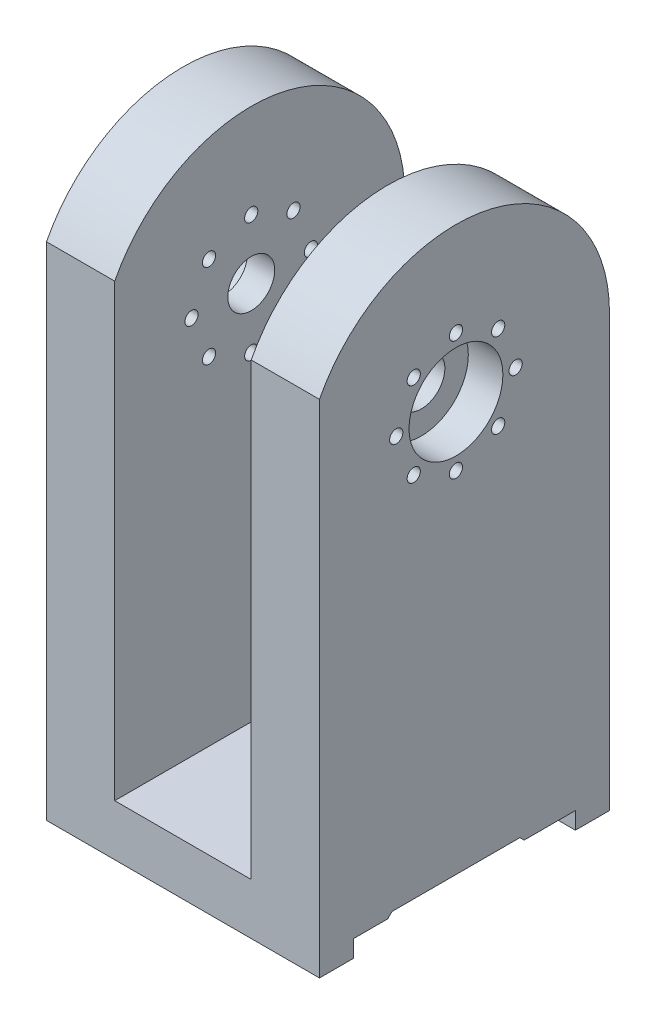
from build123d import *

# Parameters (mm, degrees)
BOSS_EXTRUDE1_DEPTH          = 101.6
CUT_EXTRUDE1_DEPTH           = 264.20443605
CUT_EXTRUDE1_DEPTH_BACK      = 264.20443605
SKETCH5_R                    = 17.4625
CUT_EXTRUDE4_DEPTH           = 15.24
CUT_EXTRUDE5_DEPTH           = 264.20443605
CUT_EXTRUDE5_DEPTH_BACK      = 264.20443605
SKETCH6_R                    = 8.73125
CUT_EXTRUDE6_START           = -12.85875
SKETCH7_R                    = 17.4625
CUT_EXTRUDE6_DEPTH           = 12.85875
F_1_4_20_TAPPED_HOLE1_D      = 5.1054
F_1_4_20_TAPPED_HOLE1_DEPTH  = 16.51
F_1_4_20_TAPPED_HOLE1_TIP    = 1.533816902
F_10_24_TAPPED_HOLE1_D       = 3.7973
F_10_24_TAPPED_HOLE1_DEPTH   = 14.9479
F_10_24_TAPPED_HOLE1_TIP     = 1.140824014
F_1_4_0_25_DIAMETER_HOLE1_D  = 6.35
F_10_0_1935_DIAMETER_HOLE1_D = 4.9149
CUT_EXTRUDE7_REACH           = 256.481
F_1_4_20_TAPPED_HOLE2_D      = 5.1054
F_1_4_20_TAPPED_HOLE2_DEPTH  = 16.51
F_1_4_20_TAPPED_HOLE2_TIP    = 1.533816902


with BuildPart() as part:
    # Sketch1 → Boss-Extrude1 (new body)
    with BuildSketch(Plane(origin=(0, 0, 0), x_dir=(0, 0, -1), z_dir=(1, 0, 0))):
        with BuildLine():
            Line((107.95, 160.3375), (107.95, 0))
            Line((107.95, 0), (95.25, 0))
            Line((95.25, 0), (95.25, 6.35))
            Line((95.25, 6.35), (76.2, 6.35))
            Line((76.2, 6.35), (74.6125, 7.9375))
            Line((74.6125, 7.9375), (26.9875, 7.9375))
            Line((26.9875, 7.9375), (25.4, 6.35))
            Line((25.4, 6.35), (12.7, 6.35))
            Line((12.7, 6.35), (12.7, 0))
            Line((12.7, 0), (0, 0))
            Line((0, 0), (0, 186.519220723))
            ThreePointArc((0, 186.519220723), (64.270384182, 215.877316798), (107.95, 160.3375))
        make_face()
    extrude(amount=BOSS_EXTRUDE1_DEPTH)

    # Sketch2 → Cut-Extrude1 (cut, two sides: drawn at the far end of the back side and taken through both)
    with BuildSketch(Plane(origin=(0, 0, -107.95), x_dir=(-1, 0, 0), z_dir=(0, 0, -1)).offset(-CUT_EXTRUDE1_DEPTH_BACK)):
        Polygon((-76.2, 98.425), (-76.2, 19.05), (-25.4, 19.05), (-25.4, 264.580157132), (-76.2, 264.580157132), align=None)
    extrude(amount=CUT_EXTRUDE1_DEPTH + CUT_EXTRUDE1_DEPTH_BACK, mode=Mode.SUBTRACT)

    # Sketch5 → Cut-Extrude4 (cut)
    with BuildSketch(Plane.ZY):
        with Locations((-50.8, 160.3375)):
            Circle(SKETCH5_R)
    extrude(amount=-CUT_EXTRUDE4_DEPTH, mode=Mode.SUBTRACT)

    # Sketch6 → Cut-Extrude5 (cut, two sides: drawn at the far end of the back side and taken through both)
    with BuildSketch(Plane.ZY.offset(-CUT_EXTRUDE5_DEPTH_BACK)):
        with Locations((-50.8, 160.3375)):
            Circle(SKETCH6_R)
    extrude(amount=CUT_EXTRUDE5_DEPTH + CUT_EXTRUDE5_DEPTH_BACK, mode=Mode.SUBTRACT)

    # Sketch7 → Cut-Extrude6 (cut)
    with BuildSketch(Plane(origin=(101.6, 0, 0), x_dir=(0, 0, -1), z_dir=(1, 0, 0)).offset(CUT_EXTRUDE6_START)):
        with Locations(Location((50.8, 160.3375, 0), (0, 0, 180))):
            Circle(SKETCH7_R)
    extrude(amount=CUT_EXTRUDE6_DEPTH, mode=Mode.SUBTRACT)

    # 1/4-20 Tapped Hole1
    with Locations(Plane(origin=(0, 0, 0), x_dir=(-1, 0, 0), z_dir=(0, -1, 0))):
        with Locations((-19.05, 6.35), (-82.55, 6.35), (-82.55, 101.6), (-19.05, 101.6)):
            Hole(F_1_4_20_TAPPED_HOLE1_D / 2, depth=F_1_4_20_TAPPED_HOLE1_DEPTH)
            with Locations((0, 0, -(F_1_4_20_TAPPED_HOLE1_DEPTH + F_1_4_20_TAPPED_HOLE1_TIP / 2))):  # 118° drill point
                Cone(0, F_1_4_20_TAPPED_HOLE1_D / 2, F_1_4_20_TAPPED_HOLE1_TIP, mode=Mode.SUBTRACT)

    # #10-24 Tapped Hole1
    with Locations(Plane(origin=(0, 0, -107.95), x_dir=(-1, 0, 0), z_dir=(0, 0, -1))):
        with Locations((-71.12, 3.175), (-30.48, 3.175)):
            Hole(F_10_24_TAPPED_HOLE1_D / 2, depth=F_10_24_TAPPED_HOLE1_DEPTH)
            with Locations((0, 0, -(F_10_24_TAPPED_HOLE1_DEPTH + F_10_24_TAPPED_HOLE1_TIP / 2))):  # 118° drill point
                Cone(0, F_10_24_TAPPED_HOLE1_D / 2, F_10_24_TAPPED_HOLE1_TIP, mode=Mode.SUBTRACT)

    # 1/4 (0.25) Diameter Hole1 (through all)
    with Locations(Plane(origin=(0, 19.05, 0), x_dir=(1, 0, 0), z_dir=(0, 1, 0))):
        with Locations((38.1, 50.8)):
            Hole(F_1_4_0_25_DIAMETER_HOLE1_D / 2)

    # #10 (0.1935) Diameter Hole1 (through all)
    with Locations(Plane.ZY):
        with Locations((-50.8, 138.1125), (-35.084551788, 144.622051788), (-28.575, 160.3375), (-35.084551788, 176.052948212), (-50.8, 182.5625), (-66.515448212, 176.052948212), (-73.025, 160.3375), (-66.515448212, 144.622051788)):
            Hole(F_10_0_1935_DIAMETER_HOLE1_D / 2)

    # Sketch18 → Cut-Extrude7 (cut, up to next)
    with BuildSketch(Plane(origin=(25.4, 0, 0), x_dir=(0, 0, -1), z_dir=(1, 0, 0)), mode=Mode.PRIVATE) as cut_extrude7_sk1:
        with BuildLine():
            Line((101.735693597, 53.742371613), (97.861527071, 45.040851129))
            ThreePointArc((97.861527071, 45.040851129), (89.477735732, 41.822615156), (86.259499759, 50.206406496))
            Line((86.259499759, 50.206406496), (90.133666285, 58.90792698))
            ThreePointArc((90.133666285, 58.90792698), (98.517457624, 62.126162953), (101.735693597, 53.742371613))
        make_face()
    cut_extrude7_tool1 = extrude(cut_extrude7_sk1.sketch, amount=-CUT_EXTRUDE7_REACH, mode=Mode.PRIVATE) & part.part
    add(cut_extrude7_tool1.solids().sort_by_distance((25.4, 51.974389, -93.997597))[0], mode=Mode.SUBTRACT)

    # 1/4-20 Tapped Hole2
    with Locations(Plane(origin=(0, 56.009710981, -24.937129984), x_dir=(1, 0, 0), z_dir=(0, 0.9135454576426035, -0.40673664307579466))):
        with Locations((31.75, 64.91550659)):
            Hole(F_1_4_20_TAPPED_HOLE2_D / 2, depth=F_1_4_20_TAPPED_HOLE2_DEPTH)
            with Locations((0, 0, -(F_1_4_20_TAPPED_HOLE2_DEPTH + F_1_4_20_TAPPED_HOLE2_TIP / 2))):  # 118° drill point
                Cone(0, F_1_4_20_TAPPED_HOLE2_D / 2, F_1_4_20_TAPPED_HOLE2_TIP, mode=Mode.SUBTRACT)


solid = part.part
